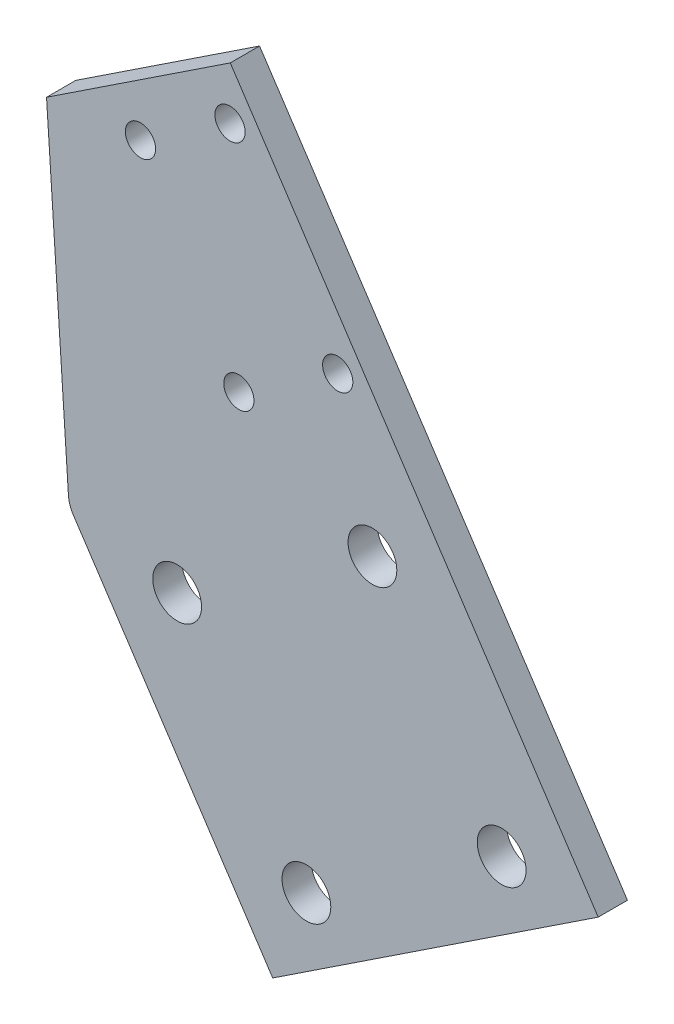
from build123d import *

# Parameters (mm, degrees)
EXTRUDE_1_DEPTH     = 3
CUT_EXTRUDE_1_DEPTH = 10
CUT_EXTRUDE_2_DEPTH = 10


with BuildPart() as part:
    # 草图1 → 凸台-拉伸1 (new body)
    with BuildSketch(Plane.XY):
        with BuildLine():
            Line((6.986719164, -53.161934409), (35.338837115, -34.396076908))
            ThreePointArc((35.338837115, -34.396076908), (36.622800273, -32.492523245), (36.184683625, -30.238608486))
            Line((36.184683625, -30.238608486), (-18.457077921, 52.316087899))
            ThreePointArc((-18.457077921, 52.316087899), (-20.360631584, 53.600051056), (-22.614546343, 53.161934409))
            Line((-22.614546343, 53.161934409), (-35.338837115, 44.739910071))
            ThreePointArc((-35.338837115, 44.739910071), (-36.370802739, 43.570865472), (-36.676585387, 42.041775777))
            Line((-36.676585387, 42.041775777), (-34.202704532, 4.349245051))
            ThreePointArc((-34.202704532, 4.349245051), (-34.051989945, 3.587476428), (-33.710802769, 2.889910923))
            Line((-33.710802769, 2.889910923), (2.829250742, -52.316087899))
            ThreePointArc((2.829250742, -52.316087899), (4.732804405, -53.600051056), (6.986719164, -53.161934409))
        make_face()
        with BuildLine():
            ThreePointArc((7.991481125, -42.903257428), (5.912746914, -42.480334173), (5.489823659, -44.559068384))
            ThreePointArc((5.489823659, -44.559068384), (7.56855787, -44.981991639), (7.991481125, -42.903257428))
        make_face(mode=Mode.SUBTRACT)
        with BuildLine():
            ThreePointArc((28.004740855, -29.65676978), (25.926006644, -29.233846525), (25.503083389, -31.312580736))
            ThreePointArc((25.503083389, -31.312580736), (27.5818176, -31.735503991), (28.004740855, -29.65676978))
        make_face(mode=Mode.SUBTRACT)
        with BuildLine():
            ThreePointArc((20.277623061, -17.982368271), (18.198888849, -17.559445016), (17.775965594, -19.638179227))
            ThreePointArc((17.775965594, -19.638179227), (19.854699805, -20.061102482), (20.277623061, -17.982368271))
        make_face(mode=Mode.SUBTRACT)
        with BuildLine():
            ThreePointArc((0.264363331, -31.228855919), (-1.81437088, -30.805932664), (-2.237294135, -32.884666875))
            ThreePointArc((-2.237294135, -32.884666875), (-0.158559924, -33.30759013), (0.264363331, -31.228855919))
        make_face(mode=Mode.SUBTRACT)
        with BuildLine():
            ThreePointArc((-7.732742612, -17.33474578), (-11.19729963, -16.629873689), (-11.902171722, -20.094430707))
            ThreePointArc((-11.902171722, -20.094430707), (-8.437614704, -20.799302799), (-7.732742612, -17.33474578))
        make_face(mode=Mode.SUBTRACT)
        with BuildLine():
            ThreePointArc((12.280517118, -4.088258133), (8.815960099, -3.383386041), (8.111088007, -6.84794306))
            ThreePointArc((8.111088007, -6.84794306), (11.575645026, -7.552815151), (12.280517118, -4.088258133))
        make_face(mode=Mode.SUBTRACT)
        with BuildLine():
            ThreePointArc((-20.97923026, 2.678513949), (-24.443787278, 3.383386041), (-25.14865937, -0.081170977))
            ThreePointArc((-25.14865937, -0.081170977), (-21.684102351, -0.786043069), (-20.97923026, 2.678513949))
        make_face(mode=Mode.SUBTRACT)
        with BuildLine():
            ThreePointArc((-0.96597053, 15.925001597), (-4.430527548, 16.629873689), (-5.13539964, 13.16531667))
            ThreePointArc((-5.13539964, 13.16531667), (-1.670842622, 12.460444578), (-0.96597053, 15.925001597))
        make_face(mode=Mode.SUBTRACT)
        with BuildLine():
            ThreePointArc((-5.315850745, 29.834747896), (-7.463876096, 30.271768593), (-7.900896793, 28.123743242))
            ThreePointArc((-7.900896793, 28.123743242), (-5.752871442, 27.686722545), (-5.315850745, 29.834747896))
        make_face(mode=Mode.SUBTRACT)
        with BuildLine():
            ThreePointArc((-15.446542758, 23.129389128), (-17.594568109, 23.566409825), (-18.031588806, 21.418384473))
            ThreePointArc((-18.031588806, 21.418384473), (-15.883563455, 20.981363776), (-15.446542758, 23.129389128))
        make_face(mode=Mode.SUBTRACT)
        with BuildLine():
            ThreePointArc((-16.354590451, 46.512464337), (-18.502615803, 46.949485034), (-18.9396365, 44.801459683))
            ThreePointArc((-18.9396365, 44.801459683), (-16.791611148, 44.364438986), (-16.354590451, 46.512464337))
        make_face(mode=Mode.SUBTRACT)
        with BuildLine():
            ThreePointArc((-25.527334494, 40.441157499), (-27.675359845, 40.878178196), (-28.112380542, 38.730152845))
            ThreePointArc((-28.112380542, 38.730152845), (-25.964355191, 38.293132148), (-25.527334494, 40.441157499))
        make_face(mode=Mode.SUBTRACT)
    extrude(amount=EXTRUDE_1_DEPTH)

    # 草图2 → 切除-拉伸1 (cut)
    with BuildSketch(Plane.XY.offset(3)):
        Polygon((-17.618504331, 51.049141407), (-36.449708749, 38.585039103), (-39.080293109, 42.559418534), (-20.249088692, 55.023520838), align=None)
        Polygon((22.294234295, -9.252428783), (-11.061198588, -31.329908196), (5.024024644, -55.632029551), (41.740524867, -31.329908196), align=None)
    extrude(amount=-CUT_EXTRUDE_1_DEPTH, mode=Mode.SUBTRACT)

    # 草图3 → 切除-拉伸2 (cut)
    with BuildSketch(Plane.XY.offset(3)):
        Polygon((-13.268946529, -27.994364908), (20.086486354, -5.916885495), (39.339377522, -11.508432246), (-14.131394495, -36.930591808), align=None)
    extrude(amount=-CUT_EXTRUDE_2_DEPTH, mode=Mode.SUBTRACT)


solid = part.part
